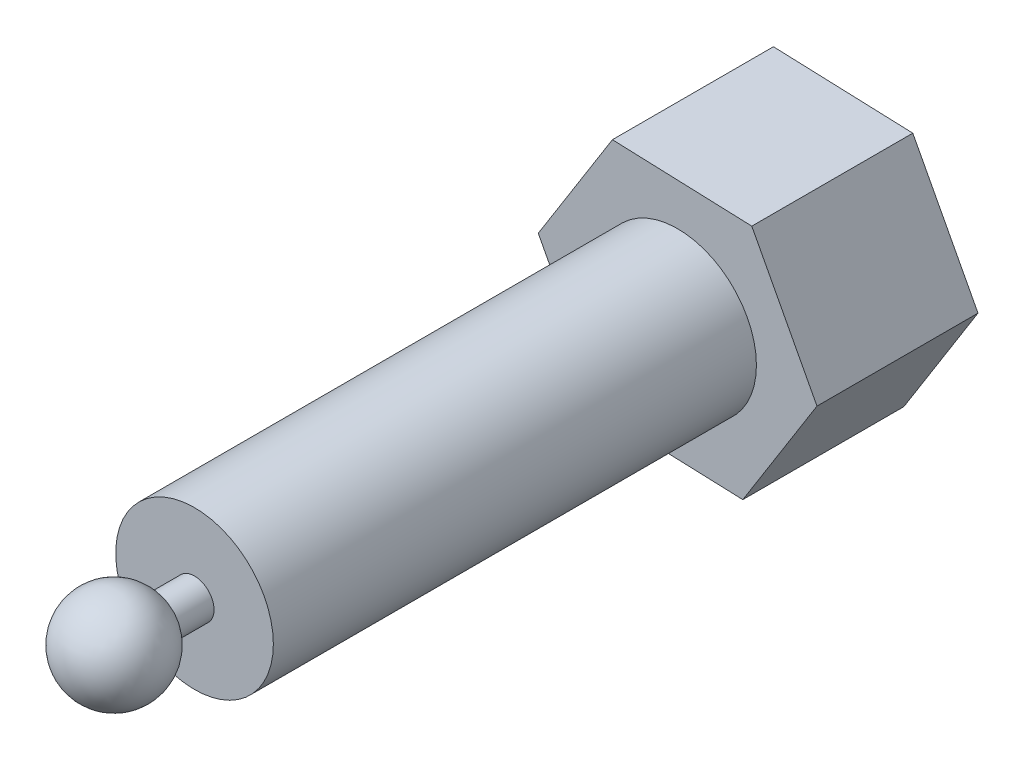
from build123d import *

# Parameters (mm, degrees)
BOSS_EXTRU_1_DEPTH = 10
BOSS_EXTRU_2_DEPTH = 10
ESQUISSE2_R        = 4.894055533
BOSS_EXTRU_3_DEPTH = 30
ESQUISSE3_R        = 1.212326076
BOSS_EXTRU_4_DEPTH = 5


with BuildPart() as part:
    # Esquisse1 → Boss.-Extru.1 (new body)
    with BuildSketch(Plane.XY):
        Polygon((4.048384121, -7.655755091), (8.654270454, -0.321874053), (4.605886333, 7.333881038), (-4.048384121, 7.655755091), (-8.654270454, 0.321874053), (-4.605886333, -7.333881038), align=None)
    extrude(amount=BOSS_EXTRU_1_DEPTH)

    # Esquisse1<2> → Boss.-Extru.2 (add)
    with BuildSketch(Plane.XY):
        Polygon((4.048384121, -7.655755091), (8.654270454, -0.321874053), (4.605886333, 7.333881038), (-4.048384121, 7.655755091), (-8.654270454, 0.321874053), (-4.605886333, -7.333881038), align=None)
    extrude(amount=BOSS_EXTRU_2_DEPTH)

    # Esquisse2 → Boss.-Extru.3 (add)
    with BuildSketch(Plane.XY.offset(10)):
        Circle(ESQUISSE2_R)
    extrude(amount=BOSS_EXTRU_3_DEPTH)

    # Esquisse3 → Boss.-Extru.4 (add)
    with BuildSketch(Plane.XY.offset(40)):
        Circle(ESQUISSE3_R)
    extrude(amount=BOSS_EXTRU_4_DEPTH)


with BuildPart() as body_2:
    # Esquisse4 → Révolution2 (revolve)
    with BuildSketch(Plane.XY.offset(45)):
        with BuildLine():
            Line((0, 3), (0, -3))
            ThreePointArc((0, -3), (3, 0), (0, 3))
        make_face()
    revolve(axis=Axis((0, 0, 45), (0, 1, 0)))


solid = Compound([part.part, body_2.part])
